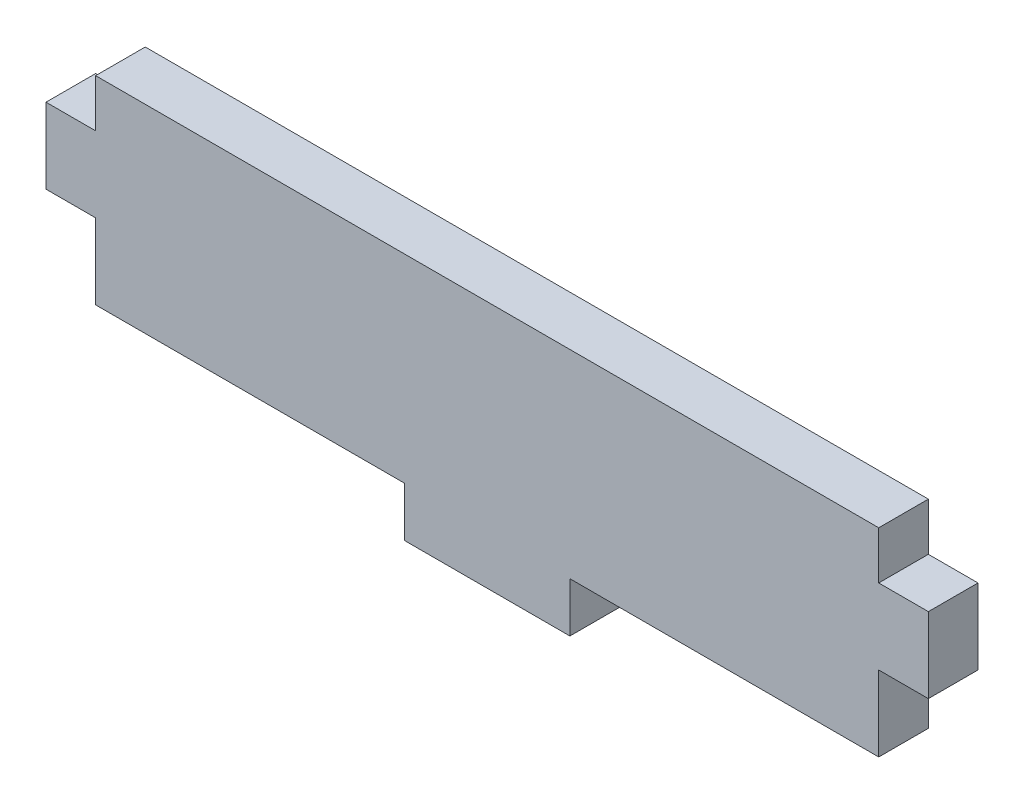
from build123d import *

# Parameters (mm, degrees)
SKETCH1_W           = 9
SKETCH1_H           = 13.666666666
SKETCH1_W_2         = 30
SKETCH1_H_2         = 9
BOSS_EXTRUDE1_DEPTH = 9


with BuildPart() as part:
    # Sketch1 → Boss-Extrude1 (new body)
    with BuildSketch(Plane.XY):
        Polygon((9, 9), (65, 9), (95, 9), (151, 9), (151, 22.666666667), (151, 36.333333333), (151, 45), (9, 45), (9, 36.333333333), (9, 22.666666667), align=None)
        with Locations((4.5, 29.5)):
            Rectangle(SKETCH1_W, SKETCH1_H)
        with Locations((80, 4.5)):
            Rectangle(SKETCH1_W_2, SKETCH1_H_2)
        with Locations((155.5, 29.5)):
            Rectangle(SKETCH1_W, SKETCH1_H)
    extrude(amount=BOSS_EXTRUDE1_DEPTH)


solid = part.part
